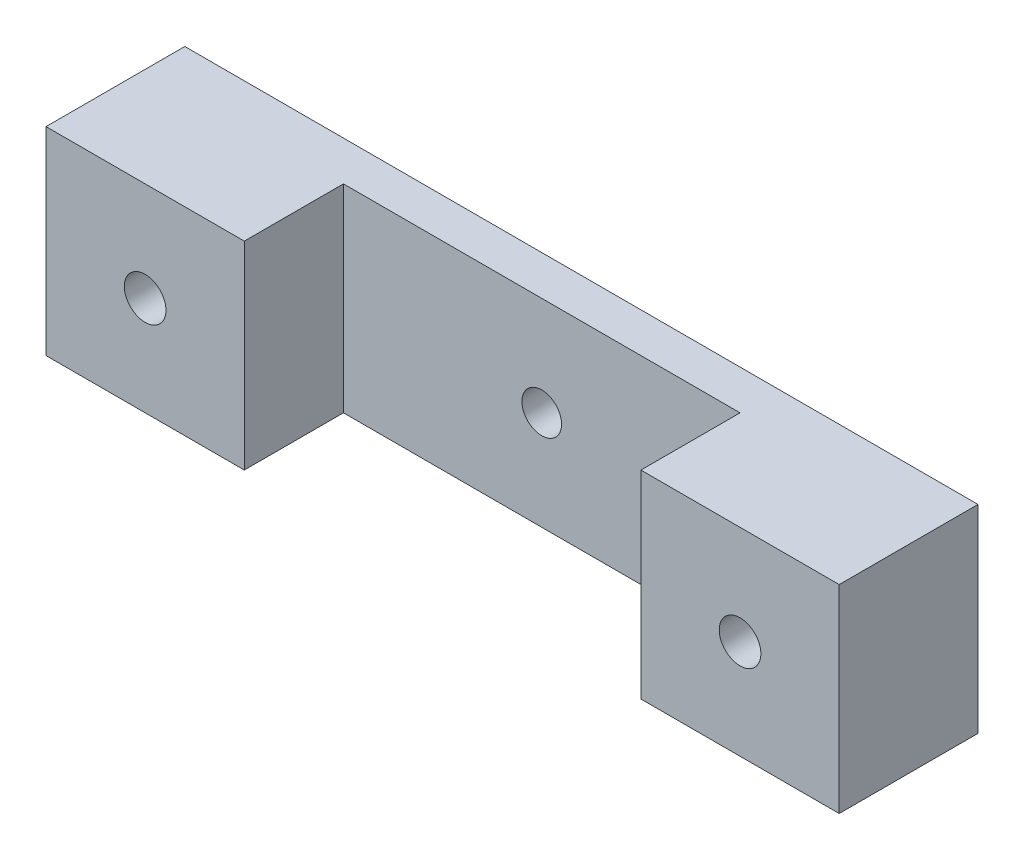
from build123d import *

# Parameters (mm, degrees)
SKETCH_1_W          = 80
SKETCH_1_H          = 20
EXTRUDE_1_DEPTH     = 4
SKETCH_2_W          = 20
SKETCH_2_H          = 20
EXTRUDE_2_DEPTH     = 10
SKETCH_3_R          = 2.1
CUT_EXTRUDE_1_DEPTH = 20
SKETCH_4_R          = 2
CUT_EXTRUDE_2_DEPTH = 20


with BuildPart() as part:
    # 草图1 → 凸台-拉伸1 (new body)
    with BuildSketch(Plane.XY):
        with Locations((40, 10)):
            Rectangle(SKETCH_1_W, SKETCH_1_H)
    extrude(amount=EXTRUDE_1_DEPTH)

    # 草图2 → 凸台-拉伸2 (add)
    with BuildSketch(Plane.XY.offset(4)):
        with Locations((10, 10)):
            Rectangle(SKETCH_2_W, SKETCH_2_H)
        with Locations((70, 10)):
            Rectangle(SKETCH_2_W, SKETCH_2_H)
    extrude(amount=EXTRUDE_2_DEPTH)

    # 草图3 → 切除-拉伸1 (cut)
    with BuildSketch(Plane.XY.offset(14)):
        with Locations((10, 10)):
            Circle(SKETCH_3_R)
        with Locations((70, 10)):
            Circle(SKETCH_3_R)
    extrude(amount=-CUT_EXTRUDE_1_DEPTH, mode=Mode.SUBTRACT)

    # 草图4 → 切除-拉伸2 (cut)
    with BuildSketch(Plane(origin=(0, 0, 0), x_dir=(-1, 0, 0), z_dir=(0, 0, -1))):
        with Locations((-40, 10)):
            Circle(SKETCH_4_R)
    extrude(amount=-CUT_EXTRUDE_2_DEPTH, mode=Mode.SUBTRACT)


solid = part.part
